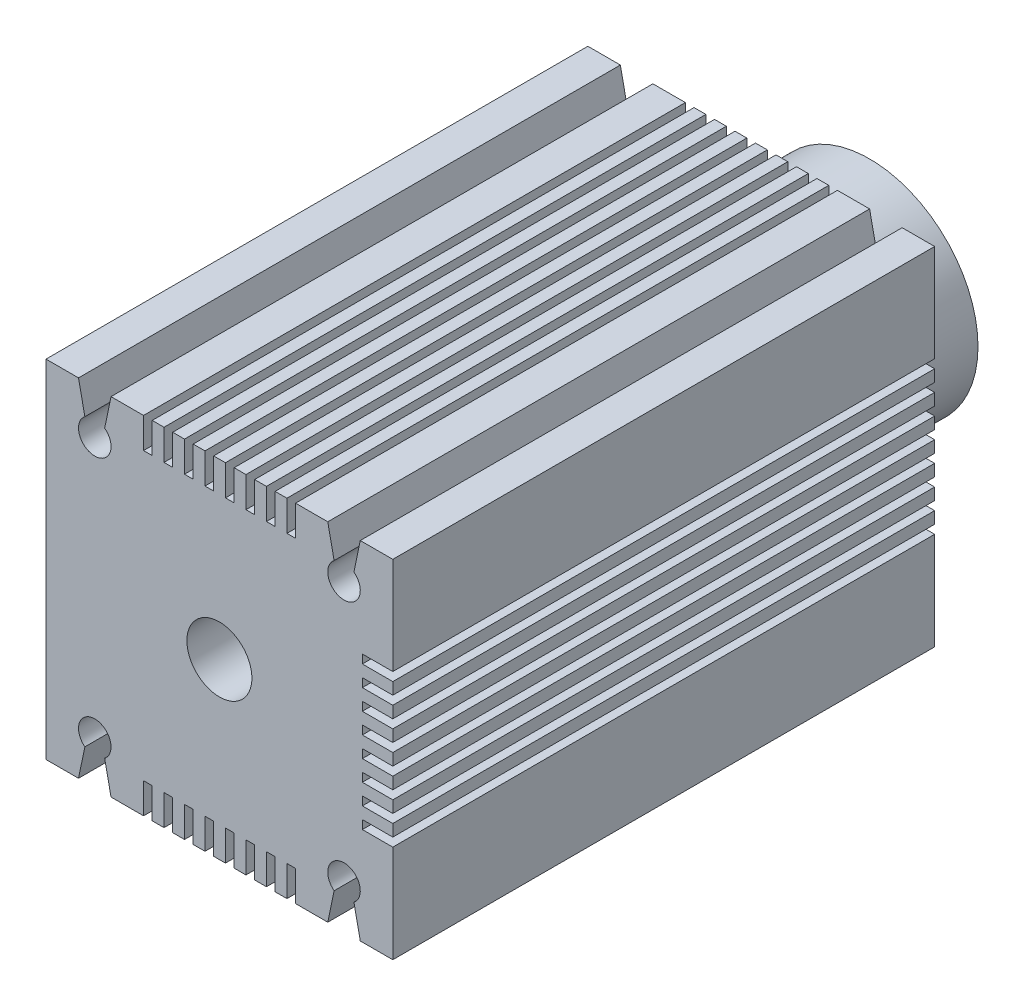
from build123d import *

# Parameters (mm, degrees)
SKETCH_1_W          = 32
SKETCH_1_H          = 32
EXTRUDE_2_DEPTH     = 50
SKETCH_3_W          = 0.8
SKETCH_3_H          = 2.810239381
SKETCH_3_W_2        = 2.81
SKETCH_3_H_2        = 0.8
CUT_EXTRUDE_1_DEPTH = 55.881690936
SKETCH_4_R          = 10
EXTRUDE_3_DEPTH     = 10
SKETCH_5_R          = 3
CUT_EXTRUDE_2_DEPTH = 65.124878168
SKETCH_6_W          = 2.81
SKETCH_6_H          = 14.03
EXTRUDE_4_DEPTH     = 50
SKETCH_7_R          = 2.5
SKETCH_7_R_2        = 1.5
CUT_EXTRUDE_3_DEPTH = 10
FILLET_1_R          = 1


with BuildPart() as part:
    # Эскиз1 → Бобышка-Вытянуть2 (new body)
    with BuildSketch(Plane.XY):
        Rectangle(SKETCH_1_W, SKETCH_1_H)
    extrude(amount=EXTRUDE_2_DEPTH)

    # Эскиз3 → Вырез-Вытянуть1 (cut, through all)
    with BuildSketch(Plane.XY.offset(50)):
        with BuildLine():
            Line((-10, 16), (-13, 16))
            Line((-13, 16), (-12.413493115, 13.189760619))
            ThreePointArc((-12.413493115, 13.189760619), (-11.5, 10.5), (-10.586506885, 13.189760619))
            Line((-10.586506885, 13.189760619), (-10, 16))
        make_face()
        with Locations((-6.6, 14.59488031)):
            Rectangle(SKETCH_3_W, SKETCH_3_H)
        with Locations((-4.71, 14.59488031)):
            Rectangle(SKETCH_3_W, SKETCH_3_H)
        with Locations((-2.82, 14.59488031)):
            Rectangle(SKETCH_3_W, SKETCH_3_H)
        with Locations((-0.93, 14.59488031)):
            Rectangle(SKETCH_3_W, SKETCH_3_H)
        with Locations((0.96, 14.59488031)):
            Rectangle(SKETCH_3_W, SKETCH_3_H)
        with Locations((2.85, 14.59488031)):
            Rectangle(SKETCH_3_W, SKETCH_3_H)
        with Locations((4.74, 14.59488031)):
            Rectangle(SKETCH_3_W, SKETCH_3_H)
        Polygon((7, 16), (6.23, 16), (6.23, 13.189760619), (7.03, 13.189760619), (7.03, 16), align=None)
        with BuildLine():
            Line((13, 16), (10, 16))
            Line((10, 16), (10.586506885, 13.189760619))
            ThreePointArc((10.586506885, 13.189760619), (11.5, 10.5), (12.413493115, 13.189760619))
            Line((12.413493115, 13.189760619), (13, 16))
        make_face()
        with Locations((-14.595, 6.63)):
            Rectangle(SKETCH_3_W_2, SKETCH_3_H_2)
        with Locations((-14.595, 4.74)):
            Rectangle(SKETCH_3_W_2, SKETCH_3_H_2)
        with Locations((-14.595, 2.85)):
            Rectangle(SKETCH_3_W_2, SKETCH_3_H_2)
        with Locations((-14.595, 0.96)):
            Rectangle(SKETCH_3_W_2, SKETCH_3_H_2)
        with Locations((-14.595, -0.93)):
            Rectangle(SKETCH_3_W_2, SKETCH_3_H_2)
        with Locations((-14.595, -2.82)):
            Rectangle(SKETCH_3_W_2, SKETCH_3_H_2)
        with Locations((-14.595, -6.6)):
            Rectangle(SKETCH_3_W_2, SKETCH_3_H_2)
        with Locations((-14.595, -4.71)):
            Rectangle(SKETCH_3_W_2, SKETCH_3_H_2)
        with BuildLine():
            Line((-12.413493115, -13.189760619), (-13, -16))
            Line((-13, -16), (-10, -16))
            Line((-10, -16), (-10.586506885, -13.189760619))
            ThreePointArc((-10.586506885, -13.189760619), (-11.5, -10.5), (-12.413493115, -13.189760619))
        make_face()
        with Locations((-6.6, -14.59488031)):
            Rectangle(SKETCH_3_W, SKETCH_3_H)
        with Locations((-4.71, -14.59488031)):
            Rectangle(SKETCH_3_W, SKETCH_3_H)
        with Locations((-2.82, -14.59488031)):
            Rectangle(SKETCH_3_W, SKETCH_3_H)
        with Locations((-0.93, -14.59488031)):
            Rectangle(SKETCH_3_W, SKETCH_3_H)
        with Locations((0.96, -14.59488031)):
            Rectangle(SKETCH_3_W, SKETCH_3_H)
        with Locations((2.85, -14.59488031)):
            Rectangle(SKETCH_3_W, SKETCH_3_H)
        with Locations((4.74, -14.59488031)):
            Rectangle(SKETCH_3_W, SKETCH_3_H)
        Polygon((6.23, -13.189760619), (6.23, -16), (7, -16), (7.03, -16), (7.03, -13.189760619), align=None)
        with BuildLine():
            Line((10.586506885, -13.189760619), (10, -16))
            Line((10, -16), (13, -16))
            Line((13, -16), (12.413493115, -13.189760619))
            ThreePointArc((12.413493115, -13.189760619), (11.5, -10.5), (10.586506885, -13.189760619))
        make_face()
        with Locations((14.595, -6.6)):
            Rectangle(SKETCH_3_W_2, SKETCH_3_H_2)
        with Locations((14.595, -4.71)):
            Rectangle(SKETCH_3_W_2, SKETCH_3_H_2)
        with Locations((14.595, -2.82)):
            Rectangle(SKETCH_3_W_2, SKETCH_3_H_2)
        with Locations((14.595, -0.93)):
            Rectangle(SKETCH_3_W_2, SKETCH_3_H_2)
        with Locations((14.595, 0.96)):
            Rectangle(SKETCH_3_W_2, SKETCH_3_H_2)
        with Locations((14.595, 2.85)):
            Rectangle(SKETCH_3_W_2, SKETCH_3_H_2)
        with Locations((14.595, 6.63)):
            Rectangle(SKETCH_3_W_2, SKETCH_3_H_2)
        with Locations((14.595, 4.74)):
            Rectangle(SKETCH_3_W_2, SKETCH_3_H_2)
    extrude(amount=-CUT_EXTRUDE_1_DEPTH, mode=Mode.SUBTRACT)

    # Эскиз4 → Бобышка-Вытянуть3 (add)
    with BuildSketch(Plane(origin=(0, 0, 0), x_dir=(-1, 0, 0), z_dir=(0, 0, -1))):
        with Locations(Location((0, 0, 0), (0, 0, 180))):
            Circle(SKETCH_4_R)
    extrude(amount=EXTRUDE_3_DEPTH)

    # Эскиз5 → Вырез-Вытянуть2 (cut, through all)
    with BuildSketch(Plane(origin=(0, 0, -10), x_dir=(-1, 0, 0), z_dir=(0, 0, -1))):
        Circle(SKETCH_5_R)
    extrude(amount=-CUT_EXTRUDE_2_DEPTH, mode=Mode.SUBTRACT)

    # Эскиз6 → Бобышка-Вытянуть4 (add)
    with BuildSketch(Plane.XY.offset(50)):
        with Locations((-14.595, 0.015)):
            Rectangle(SKETCH_6_W, SKETCH_6_H)
    extrude(amount=-EXTRUDE_4_DEPTH)

    # Эскиз7 → Вырез-Вытянуть3 (cut)
    with BuildSketch(Plane.ZY.offset(16)):
        with Locations(Location((25, 0, 0), (0, 0, 270))):
            Circle(SKETCH_7_R)
        with Locations(Location((4.5, 8, 0), (0, 0, 270))):
            Circle(SKETCH_7_R_2)
        with Locations(Location((4.5, -8, 0), (0, 0, 270))):
            Circle(SKETCH_7_R_2)
        with Locations(Location((4.5, 0, 0), (0, 0, 270))):
            Circle(SKETCH_7_R_2)
        with Locations(Location((45.5, 0, 0), (0, 0, 270))):
            Circle(SKETCH_7_R_2)
        with Locations(Location((45.5, -8, 0), (0, 0, 270))):
            Circle(SKETCH_7_R_2)
        with Locations(Location((45.5, 8, 0), (0, 0, 270))):
            Circle(SKETCH_7_R_2)
    extrude(amount=-CUT_EXTRUDE_3_DEPTH, mode=Mode.SUBTRACT)

    # Скругление1
    fillet_1_edges = [part.edges().sort_by_distance(p)[0] for p in [
        (-16, 9.5, 45.5),
        (-16, 1.5, 45.5),
        (-16, -6.5, 45.5),
        (-16, 2.5, 25),
        (-16, 9.5, 4.5),
        (-16, 1.5, 4.5),
        (-16, -6.5, 4.5),
    ]]
    fillet(fillet_1_edges, radius=FILLET_1_R)


solid = part.part
